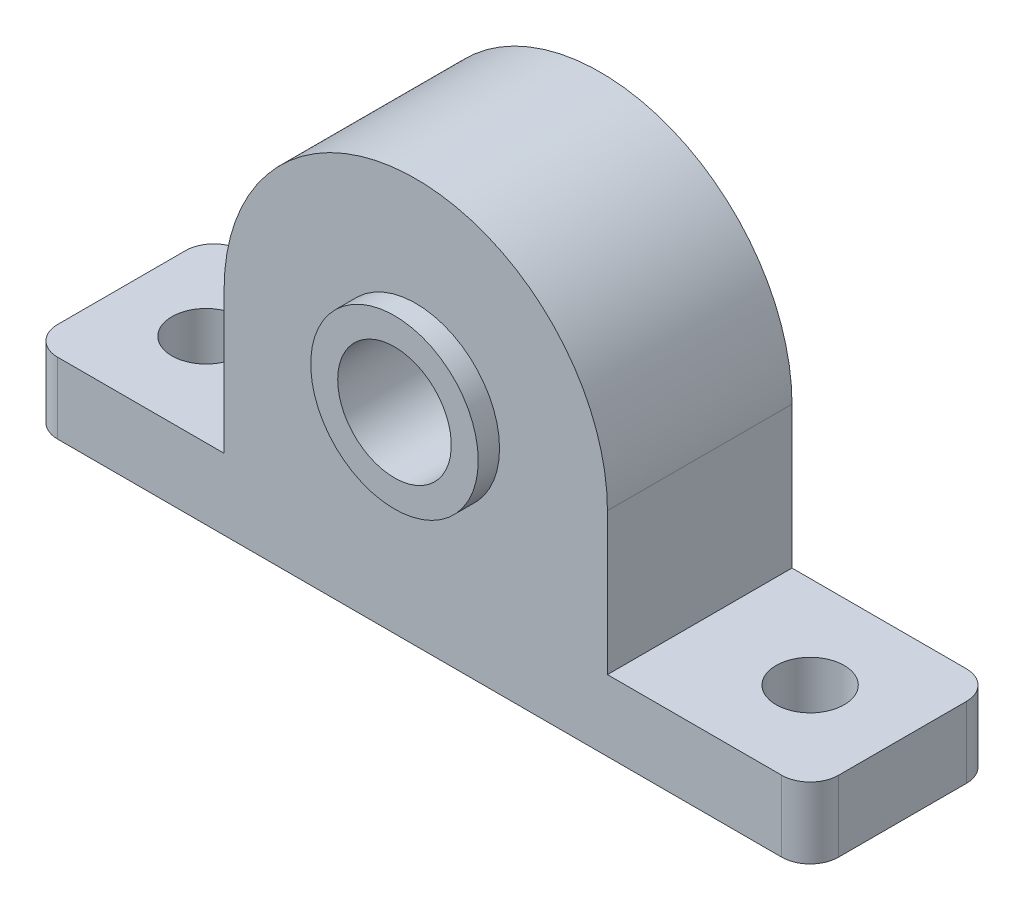
from build123d import *

# Parameters (mm, degrees)
SKETCH2_R           = 4
BOSS_EXTRUDE1_DEPTH = 13
SKETCH3_R           = 5.9
SKETCH3_R_2         = 4
BOSS_EXTRUDE2_DEPTH = 1.5
SKETCH4_R           = 2.4
CUT_EXTRUDE1_DEPTH  = 5
FILLET1_R           = 2
FILLET2_R           = 2


with BuildPart() as part:
    # Sketch2 → Boss-Extrude1 (new body)
    with BuildSketch(Plane.XY):
        with BuildLine():
            Line((0, 0), (55, 0))
            Line((55, 0), (55, 5))
            Line((55, 5), (40.722217225, 5))
            Line((40.722217225, 5), (40.722217225, 15))
            ThreePointArc((40.722217225, 15), (27.222217225, 28.5), (13.722217225, 15))
            Line((13.722217225, 15), (13.722217225, 5))
            Line((13.722217225, 5), (0, 5))
            Line((0, 5), (0, 0))
        make_face()
        with Locations(Location((27.222217225, 15, 0), (0, 0, 180))):
            Circle(SKETCH2_R, mode=Mode.SUBTRACT)
    extrude(amount=BOSS_EXTRUDE1_DEPTH)

    # Sketch3 → Boss-Extrude2 (add)
    with BuildSketch(Plane.XY.offset(13)):
        with Locations((27.222217225, 15)):
            Circle(SKETCH3_R)
        with Locations(Location((27.222217225, 15, 0), (0, 0, 180))):
            Circle(SKETCH3_R_2, mode=Mode.SUBTRACT)
    extrude(amount=BOSS_EXTRUDE2_DEPTH)

    # Sketch4 → Cut-Extrude1 (cut)
    with BuildSketch(Plane(origin=(0, 5, 0), x_dir=(1, 0, 0), z_dir=(0, 1, 0))):
        with Locations(Location((48.5, -6.5, 0), (0, 0, 180))):
            Circle(SKETCH4_R)
        with Locations((5.944434451, -6.5)):
            Circle(SKETCH4_R)
    extrude(amount=-CUT_EXTRUDE1_DEPTH, mode=Mode.SUBTRACT)

    # Fillet1
    fillet1_edges = [part.edges().sort_by_distance(p)[0] for p in [
        (55, 2.5, 13),
    ]]
    fillet(fillet1_edges, radius=FILLET1_R)

    # Fillet2
    fillet2_edges = [part.edges().sort_by_distance(p)[0] for p in [
        (0, 2.5, 0),
        (0, 2.5, 13),
        (55, 2.5, 0),
    ]]
    fillet(fillet2_edges, radius=FILLET2_R)


solid = part.part
